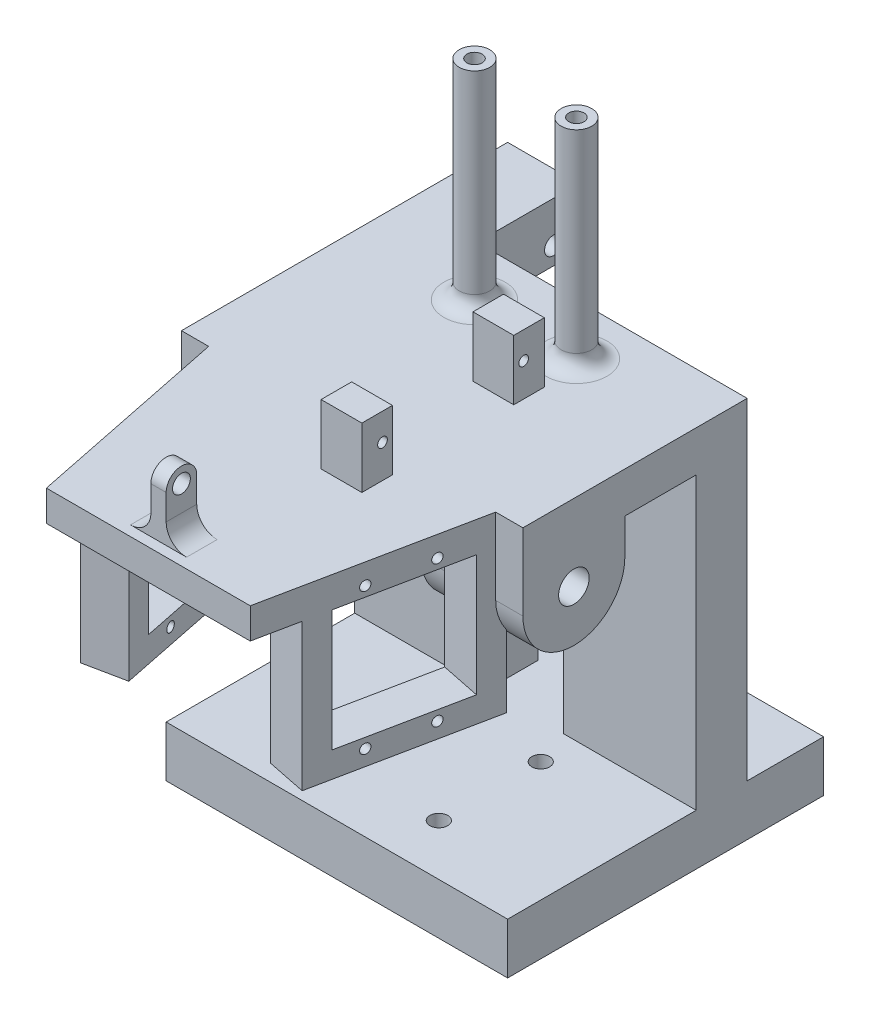
from build123d import *

# Parameters (mm, degrees)
SKETCH_1_W             = 67
SKETCH_1_H             = 62
EXTRUDE_1_DEPTH        = 10
SKETCH_3_W             = 14
SKETCH_3_H             = 20
EXTRUDE_2_DEPTH        = 12.5
SKETCH_4_W             = 10
SKETCH_4_H             = 65
EXTRUDE_3_DEPTH        = 67
SKETCH_5_W             = 67
SKETCH_5_H             = 44
EXTRUDE_4_DEPTH        = 8
EXTRUDE_5_DEPTH        = 20
CUT_EXTRUDE_START      = -6
CUT_EXTRUDE_1_DEPTH    = 8
EXTRUDE_6_DEPTH        = 6
SKETCH_9_R             = 3
CUT_EXTRUDE_2_DEPTH    = 23
SKETCH_10_W            = 24
SKETCH_10_H            = 23.8
EXTRUDE_7_DEPTH        = 8
SKETCH_12_W            = 14
SKETCH_12_H            = 20
EXTRUDE_8_DEPTH        = 11.5
SKETCH_13_R            = 0.95
CUT_EXTRUDE_4_DEPTH    = 8
SKETCH_14_W            = 8
SKETCH_14_H            = 6
EXTRUDE_9_DEPTH        = 11.8
SKETCH_15_R            = 0.95
CUT_EXTRUDE_5_DEPTH    = 11.8
SKETCH_16_W            = 3
SKETCH_16_H            = 6
EXTRUDE_10_DEPTH       = 12
FILLET_1_RADIUS        = 3
FILLET_1_LENGTH        = 3
SKETCH_17_R            = 1.75
CUT_EXTRUDE_6_DEPTH    = 7
SKETCH_18_R            = 3
EXTRUDE_11_DEPTH       = 41
FILLET_2_R             = 3
FILLET_2_OF_MIRROR_1_R = 3
SKETCH_20_R            = 1.75
CUT_EXTRUDE_7_DEPTH    = 35
SKETCH_21_W            = 15
SKETCH_21_H            = 55
CUT_EXTRUDE_8_DEPTH    = 35
SKETCH_24_R            = 1.75
CUT_EXTRUDE_11_DEPTH   = 18
SKETCH_25_R            = 1.5
CUT_EXTRUDE_12_DEPTH   = 10
FILLET_3_R             = 4
SKETCH_26_W            = 9.8
SKETCH_26_H            = 3.6
EXTRUDE_12_DEPTH       = 1
SKETCH_27_R            = 1.4
CUT_EXTRUDE_13_DEPTH   = 4


with BuildPart() as part:
    # 草图1 → 凸台-拉伸1 (new body)
    with BuildSketch(Plane(origin=(0, 0, 0), x_dir=(1, 0, 0), z_dir=(0, 1, 0))):
        Rectangle(SKETCH_1_W, SKETCH_1_H)
    extrude(amount=EXTRUDE_1_DEPTH)

    # 草图3 → 凸台-拉伸2 (add)
    with BuildSketch(Plane(origin=(0, 10, 0), x_dir=(1, 0, 0), z_dir=(0, 1, 0))):
        with Locations((-26.5, 26)):
            Rectangle(SKETCH_3_W, SKETCH_3_H)
    extrude(amount=EXTRUDE_2_DEPTH)

    # 草图4 → 凸台-拉伸3 (add)
    with BuildSketch(Plane.ZY.offset(33.5)):
        with Locations((-11, 42.5)):
            Rectangle(SKETCH_4_W, SKETCH_4_H)
    extrude(amount=-EXTRUDE_3_DEPTH)

    # 草图5 → 凸台-拉伸4 (add)
    with BuildSketch(Plane(origin=(0, 75, 0), x_dir=(1, 0, 0), z_dir=(0, 1, 0))):
        with Locations((0, -6)):
            Rectangle(SKETCH_5_W, SKETCH_5_H)
    extrude(amount=-EXTRUDE_4_DEPTH)

    # 草图6 → 凸台-拉伸5 (add)
    with BuildSketch(Plane(origin=(33.5, 0, 0), x_dir=(0, 0, -1), z_dir=(1, 0, 0))):
        with BuildLine():
            Line((-28, 60), (-28, 67))
            Line((-28, 67), (-8, 67))
            Line((-8, 67), (-8, 60))
            ThreePointArc((-8, 60), (-18, 50), (-28, 60))
        make_face()
    extrude_5 = extrude(amount=-EXTRUDE_5_DEPTH)

    # 草图7 → 切除-拉伸1 (cut)
    with BuildSketch(Plane(origin=(33.5, 0, 0), x_dir=(0, 0, -1), z_dir=(1, 0, 0)).offset(CUT_EXTRUDE_START)):
        with BuildLine():
            Line((-28, 60), (-28, 70.000230089))
            Line((-28, 70.000230089), (-8, 70.000230089))
            Line((-8, 70.000230089), (-8, 60))
            ThreePointArc((-8, 60), (-18, 50), (-28, 60))
        make_face()
    cut_extrude_1 = extrude(amount=-CUT_EXTRUDE_1_DEPTH, mode=Mode.SUBTRACT)

    # 草图8 → 凸台-拉伸6 (add)
    with BuildSketch(Plane(origin=(0, 75, 0), x_dir=(1, 0, 0), z_dir=(0, 1, 0))):
        Polygon((0, -68), (20, -68), (28.158917045, -28), (0, -28), align=None)
    extrude_6 = extrude(amount=-EXTRUDE_6_DEPTH)

    # 草图9 → 切除-拉伸2 (cut)
    with BuildSketch(Plane(origin=(33.5, 0, 0), x_dir=(0, 0, -1), z_dir=(1, 0, 0))):
        with Locations((-18, 60)):
            Circle(SKETCH_9_R)
    cut_extrude_2 = extrude(amount=-CUT_EXTRUDE_2_DEPTH, mode=Mode.SUBTRACT)

    # 草图10 → 凸台-拉伸7 (add)
    with BuildSketch(Plane(origin=(32.517279057, 0, 6.632644559), x_dir=(0.19985775636309452, 0, -0.9798249217189313), z_dir=(0.9798249217189313, 0, 0.19985775636309452))):
        Polygon((-49, 75), (-20, 75), (-20, 40.2), (-48, 40.2), (-54, 40.2), (-54, 75), align=None)
        with Locations((-37, 57.1)):
            Rectangle(SKETCH_10_W, SKETCH_10_H, mode=Mode.SUBTRACT)
    extrude_7 = extrude(amount=-EXTRUDE_7_DEPTH)

    # 草图12 → 凸台-拉伸8 (add)
    with BuildSketch(Plane(origin=(0, 75, 0), x_dir=(1, 0, 0), z_dir=(0, 1, 0))):
        with Locations((-26.5, 26)):
            Rectangle(SKETCH_12_W, SKETCH_12_H)
    extrude(amount=-EXTRUDE_8_DEPTH)

    # 草图13 → 切除-拉伸4 (cut)
    with BuildSketch(Plane(origin=(24.678679684, 0, 5.033782508), x_dir=(-0.19985775636309505, 0, 0.9798249217189313), z_dir=(-0.9798249217189313, 0, -0.19985775636309505))):
        with Locations((43.5, 70.95)):
            Circle(SKETCH_13_R)
        with Locations((31.5, 70.95)):
            Circle(SKETCH_13_R)
        with Locations((31.5, 43.25)):
            Circle(SKETCH_13_R)
        with Locations((43.5, 43.25)):
            Circle(SKETCH_13_R)
    cut_extrude_4 = extrude(amount=-CUT_EXTRUDE_4_DEPTH, mode=Mode.SUBTRACT)

    # 草图14 → 凸台-拉伸9 (add)
    with BuildSketch(Plane(origin=(0, 75, 0), x_dir=(1, 0, 0), z_dir=(0, 1, 0))):
        with Locations((7.7, -5)):
            Rectangle(SKETCH_14_W, SKETCH_14_H)
        with Locations((7.7, -34.8)):
            Rectangle(SKETCH_14_W, SKETCH_14_H)
    extrude(amount=EXTRUDE_9_DEPTH)

    # 草图15 → 切除-拉伸5 (cut)
    with BuildSketch(Plane.ZY.offset(-3.7)):
        with Locations((33.75, 81.5)):
            Circle(SKETCH_15_R)
        with Locations((6.05, 81.5)):
            Circle(SKETCH_15_R)
    extrude(amount=-CUT_EXTRUDE_5_DEPTH, mode=Mode.SUBTRACT)

    # 草图16 → 凸台-拉伸10 (add)
    with BuildSketch(Plane(origin=(0, 75, 0), x_dir=(1, 0, 0), z_dir=(0, 1, 0))):
        with Locations((0, -63)):
            Rectangle(SKETCH_16_W, SKETCH_16_H)
    extrude(amount=EXTRUDE_10_DEPTH)

    # 圆角1: full round fillet: the end face becomes a half cylinder, R = half its width
    fillet_1_face = Plane((0, 87, 63), x_dir=(1, 0, 0), z_dir=(0, 1, 0))  # on the end face: x along it, z out of the body
    fillet_1_slab = fillet_1_face.offset(-FILLET_1_RADIUS / 2) * Box(FILLET_1_LENGTH, 2 * FILLET_1_RADIUS, FILLET_1_RADIUS, mode=Mode.PRIVATE)  # the body's end, R deep
    fillet_1_round = Plane((0, 84, 63), x_dir=(0, 1, 0), z_dir=(1, 0, 0)) * Cylinder(FILLET_1_RADIUS, FILLET_1_LENGTH, mode=Mode.PRIVATE)  # its axis R under the face
    add(fillet_1_slab - fillet_1_round, mode=Mode.SUBTRACT)

    # 草图17 → 切除-拉伸6 (cut)
    with BuildSketch(Plane.ZY.offset(1.5)):
        with Locations((63, 84)):
            Circle(SKETCH_17_R)
    extrude(amount=-CUT_EXTRUDE_6_DEPTH, mode=Mode.SUBTRACT)

    # 草图18 → 凸台-拉伸11 (add)
    with BuildSketch(Plane(origin=(0, 75, 0), x_dir=(1, 0, 0), z_dir=(0, 1, 0))):
        with Locations(Location((10, 6, 0), (0, 0, 270))):
            Circle(SKETCH_18_R)
    extrude_11 = extrude(amount=EXTRUDE_11_DEPTH)

    # 圆角2
    fillet_2_edges = [part.edges().sort_by_distance(p)[0] for p in [
        (10, 75, -9),
    ]]
    fillet(fillet_2_edges, radius=FILLET_2_R)

    # 镜向1: 凸台-拉伸5, 切除-拉伸1, 凸台-拉伸6, 切除-拉伸2, 凸台-拉伸7, 切除-拉伸4, 凸台-拉伸11 across plane
    add(extrude_5.mirror(Plane(origin=(0, 0, 0), x_dir=(0, 0, 1), z_dir=(1, 0, 0))))
    add(cut_extrude_1.mirror(Plane(origin=(0, 0, 0), x_dir=(0, 0, 1), z_dir=(1, 0, 0))), mode=Mode.SUBTRACT)
    add(extrude_6.mirror(Plane(origin=(0, 0, 0), x_dir=(0, 0, 1), z_dir=(1, 0, 0))))
    add(cut_extrude_2.mirror(Plane(origin=(0, 0, 0), x_dir=(0, 0, 1), z_dir=(1, 0, 0))), mode=Mode.SUBTRACT)
    add(extrude_7.mirror(Plane(origin=(0, 0, 0), x_dir=(0, 0, 1), z_dir=(1, 0, 0))))
    add(cut_extrude_4.mirror(Plane(origin=(0, 0, 0), x_dir=(0, 0, 1), z_dir=(1, 0, 0))), mode=Mode.SUBTRACT)
    add(extrude_11.mirror(Plane(origin=(0, 0, 0), x_dir=(0, 0, 1), z_dir=(1, 0, 0))))

    # 圆角2 of 镜向1
    fillet_2_of_mirror_1_edges = [part.edges().sort_by_distance(p)[0] for p in [
        (-10, 75, -9),
    ]]
    fillet(fillet_2_of_mirror_1_edges, radius=FILLET_2_OF_MIRROR_1_R)

    # 草图20 → 切除-拉伸7 (cut)
    with BuildSketch(Plane.ZY.offset(33.5)):
        with Locations((-31, 67)):
            Circle(SKETCH_20_R)
        with Locations((-21, 67)):
            Circle(SKETCH_20_R)
        with Locations((-31, 19)):
            Circle(SKETCH_20_R)
        with Locations((-21, 19)):
            Circle(SKETCH_20_R)
    extrude(amount=-CUT_EXTRUDE_7_DEPTH, mode=Mode.SUBTRACT)

    # 草图21 → 切除-拉伸8 (cut)
    with BuildSketch(Plane(origin=(0, 0, -16), x_dir=(-1, 0, 0), z_dir=(0, 0, -1))):
        with Locations((0, 37.5)):
            Rectangle(SKETCH_21_W, SKETCH_21_H)
    extrude(amount=-CUT_EXTRUDE_8_DEPTH, mode=Mode.SUBTRACT)

    # 草图24 → 切除-拉伸11 (cut)
    with BuildSketch(Plane(origin=(0, 10, 0), x_dir=(1, 0, 0), z_dir=(0, 1, 0))):
        with Locations(Location((-10, -21, 0), (0, 0, 270))):
            Circle(SKETCH_24_R)
        with Locations(Location((10, -21, 0), (0, 0, 270))):
            Circle(SKETCH_24_R)
        with Locations(Location((-10, -1, 0), (0, 0, 270))):
            Circle(SKETCH_24_R)
        with Locations(Location((10, -1, 0), (0, 0, 270))):
            Circle(SKETCH_24_R)
    extrude(amount=-CUT_EXTRUDE_11_DEPTH, mode=Mode.SUBTRACT)

    # 草图25 → 切除-拉伸12 (cut)
    with BuildSketch(Plane(origin=(0, 116, 0), x_dir=(1, 0, 0), z_dir=(0, 1, 0))):
        with Locations(Location((10, 6, 0), (0, 0, 270))):
            Circle(SKETCH_25_R)
        with Locations(Location((-10, 6, 0), (0, 0, 270))):
            Circle(SKETCH_25_R)
    extrude(amount=-CUT_EXTRUDE_12_DEPTH, mode=Mode.SUBTRACT)

    # 圆角3
    fillet_3_edges = [part.edges().sort_by_distance(p)[0] for p in [
        (-1.5, 75, 63),
        (1.5, 75, 63),
    ]]
    fillet(fillet_3_edges, radius=FILLET_3_R)

    # 草图26 → 凸台-拉伸12 (add)
    with BuildSketch(Plane.XZ.offset(-69)):
        with Locations((0, 61.95)):
            Rectangle(SKETCH_26_W, SKETCH_26_H)
    extrude(amount=EXTRUDE_12_DEPTH)

    # 草图27 → 切除-拉伸13 (cut)
    with BuildSketch(Plane.XZ.offset(-68)):
        with Locations(Location((0, 62, 0), (0, 0, 270))):
            Circle(SKETCH_27_R)
    extrude(amount=-CUT_EXTRUDE_13_DEPTH, mode=Mode.SUBTRACT)


solid = part.part
